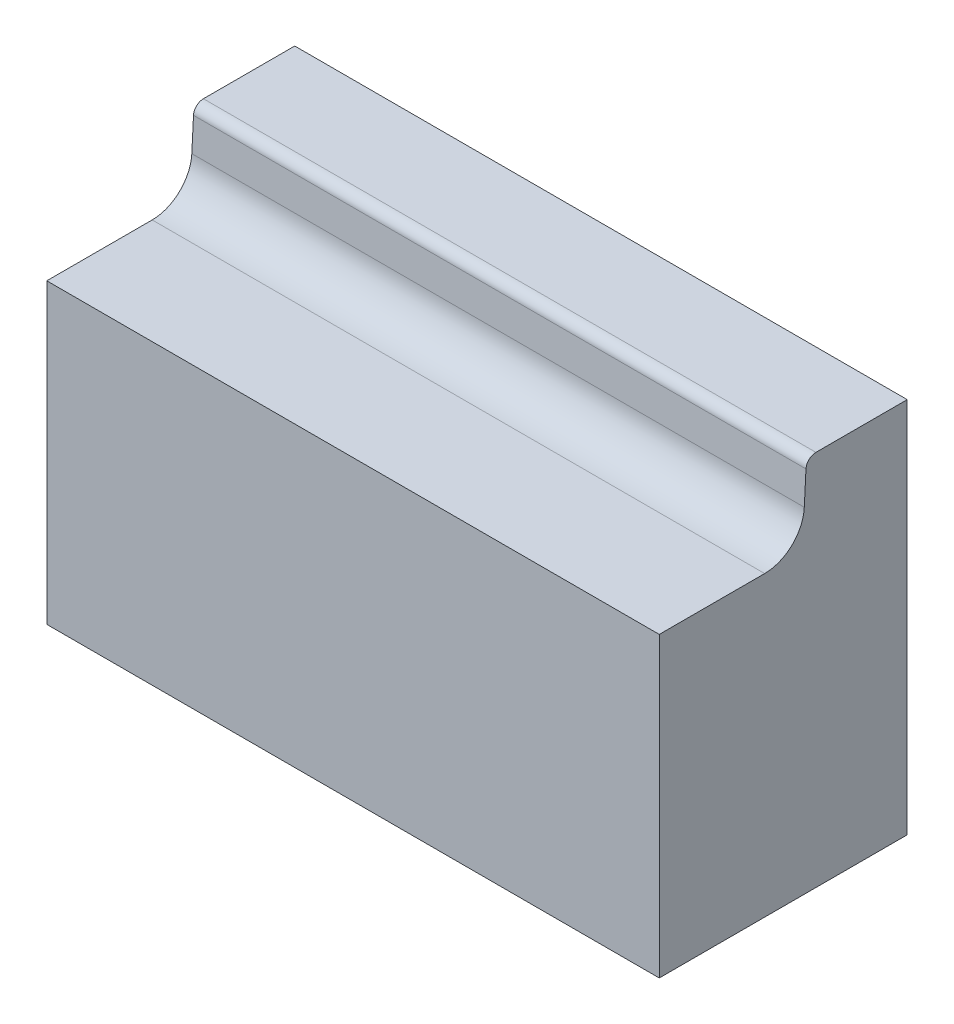
from build123d import *

# Parameters (mm, degrees)
SKETCH1_W             = 61.75
SKETCH1_H             = 38
BOSS_EXTRUDE1_DEPTH   = 12.5
CUT_EXTRUDE1_REACH    = 75.575
FILLET1_R             = 1
M6_TAPPED_HOLE1_D     = 5
M6_TAPPED_HOLE1_DEPTH = 17
M6_TAPPED_HOLE1_TIP   = 1.502151548


with BuildPart() as part:
    # Sketch1 → Boss-Extrude1 (new, symmetric)
    with BuildSketch(Plane.XY):
        with Locations((36.981465557, -19)):
            Rectangle(SKETCH1_W, SKETCH1_H)
    extrude(amount=BOSS_EXTRUDE1_DEPTH, both=True)

    # Sketch2 → Cut-Extrude1 (cut, up to next)
    with BuildSketch(Plane(origin=(67.856465557, 0, 0), x_dir=(0, 0, -1), z_dir=(1, 0, 0)), mode=Mode.PRIVATE) as cut_extrude1_sk1:
        with BuildLine():
            Line((2.342754418, 0), (2.122152056, -4.209343825))
            ThreePointArc((2.122152056, -4.209343825), (0.88105222, -6.901497484), (-1.872366083, -8))
            Line((-1.872366083, -8), (-12.5, -8))
            Line((-12.5, -8), (-12.5, 0))
            Line((-12.5, 0), (2.342754418, 0))
        make_face()
    cut_extrude1_tool1 = extrude(cut_extrude1_sk1.sketch, amount=-CUT_EXTRUDE1_REACH, mode=Mode.PRIVATE) & part.part
    add(cut_extrude1_tool1.solids().sort_by_distance((67.856466, -3.896267, 5.35091))[0], mode=Mode.SUBTRACT)

    # Fillet1
    fillet1_edges = [part.edges().sort_by_distance(p)[0] for p in [
        (36.981465557, 0, -2.342754418),
    ]]
    fillet(fillet1_edges, radius=FILLET1_R)

    # M6 Tapped Hole1
    with Locations(Plane(origin=(0, -38, 0), x_dir=(-1, 0, 0), z_dir=(0, -1, 0))):
        with Locations((-57.981465557, 0), (-15.981465557, 0)):
            Hole(M6_TAPPED_HOLE1_D / 2, depth=M6_TAPPED_HOLE1_DEPTH)
            with Locations((0, 0, -(M6_TAPPED_HOLE1_DEPTH + M6_TAPPED_HOLE1_TIP / 2))):  # 118° drill point
                Cone(0, M6_TAPPED_HOLE1_D / 2, M6_TAPPED_HOLE1_TIP, mode=Mode.SUBTRACT)


solid = part.part
